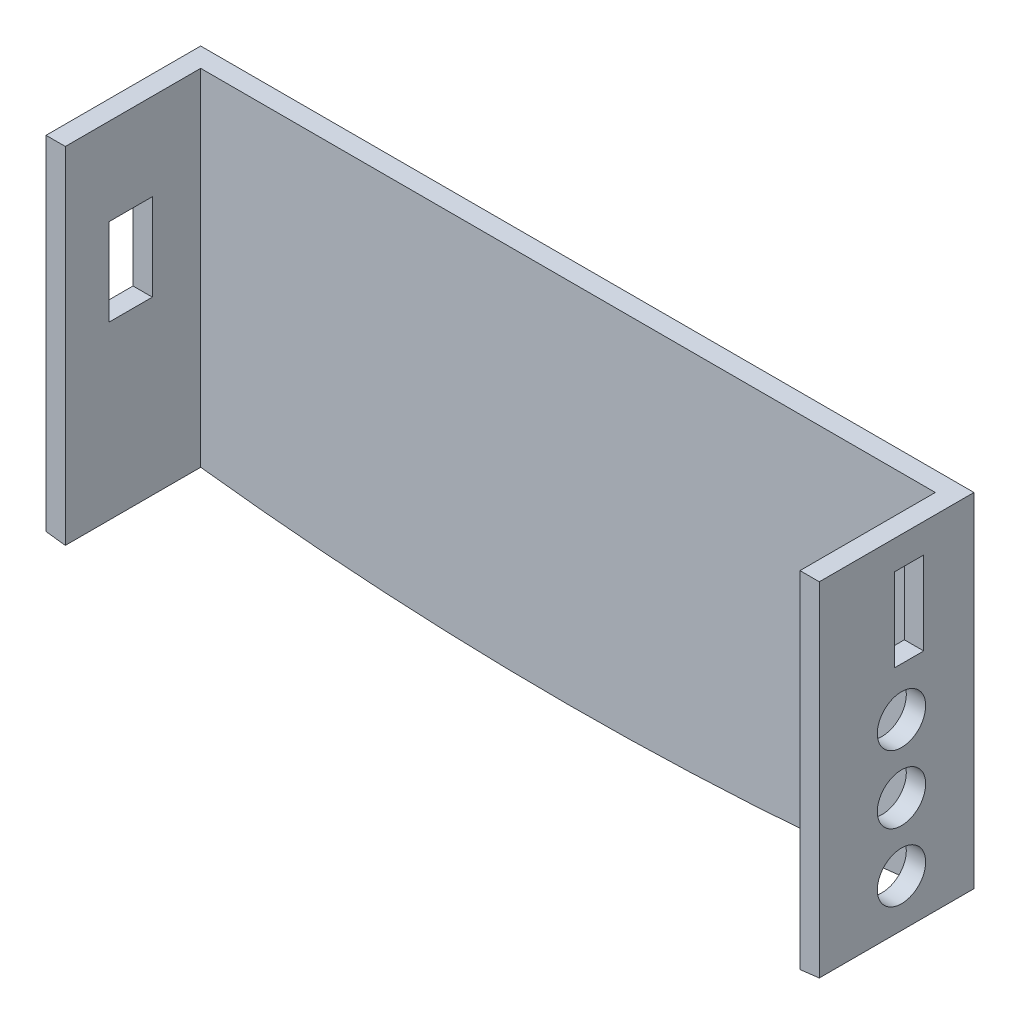
from build123d import *

# Parameters (mm, degrees)
SKETCH_1_W          = 80
SKETCH_1_H          = 35.5
EXTRUDE_1_DEPTH     = 16
SHELL_1_T           = -2
CUT_EXTRUDE_3_REACH = 89.513
SKETCH_2_W          = 4.5
SKETCH_2_H          = 9
CUT_EXTRUDE_4_REACH = 89.513
SKETCH_6_R          = 2.5
SKETCH_6_W          = 3
SKETCH_6_H          = 8.6


with BuildPart() as part:
    # 草图1 → 凸台-拉伸1 (new body)
    with BuildSketch(Plane.XY):
        with Locations((-50.420566467, -11.417328482)):
            Rectangle(SKETCH_1_W, SKETCH_1_H)
        with BuildLine():
            Line((-10.420566467, -29.167328482), (-90.420566467, -29.167328482))
            ThreePointArc((-90.420566467, -29.167328482), (-50.420566467, -31.663413079), (-10.420566467, -29.167328482))
        make_face()
    extrude(amount=EXTRUDE_1_DEPTH)

    # 抽壳1
    shell_1_openings = [part.faces().sort_by_distance(p)[0] for p in [
        (-50.420566467, -12.25744671, 16),
        (-50.420566467, 6.332671518, 8),
        (-50.420566467, -31.663413079, 8),
    ]]
    offset(amount=SHELL_1_T, openings=shell_1_openings, kind=Kind.INTERSECTION)

    # 草图2 → 切除-拉伸3 (cut, up to next)
    with BuildSketch(Plane.ZY.offset(90.420566467), mode=Mode.PRIVATE) as cut_extrude_3_sk1:
        with Locations((9.25, -7.167328482)):
            Rectangle(SKETCH_2_W, SKETCH_2_H)
    cut_extrude_3_tool1 = extrude(cut_extrude_3_sk1.sketch, amount=-CUT_EXTRUDE_3_REACH, mode=Mode.PRIVATE) & part.part
    add(cut_extrude_3_tool1.solids().sort_by_distance((-90.420566, -7.167328, 9.25))[0], mode=Mode.SUBTRACT)

    # 草图6 → 切除-拉伸4 (cut, up to next)
    with BuildSketch(Plane(origin=(-10.420566467, 0, 0), x_dir=(0, 0, -1), z_dir=(1, 0, 0)), mode=Mode.PRIVATE) as cut_extrude_4_sk1:
        with Locations((-7.5, -10.267328482)):
            Circle(SKETCH_6_R)
    cut_extrude_4_tool1 = extrude(cut_extrude_4_sk1.sketch, amount=-CUT_EXTRUDE_4_REACH, mode=Mode.PRIVATE) & part.part
    # 草图6 → 切除-拉伸4 (cut, up to next)
    with BuildSketch(Plane(origin=(-10.420566467, 0, 0), x_dir=(0, 0, -1), z_dir=(1, 0, 0)), mode=Mode.PRIVATE) as cut_extrude_4_sk2:
        with Locations((-7.5, -17.267328482)):
            Circle(SKETCH_6_R)
    cut_extrude_4_tool2 = extrude(cut_extrude_4_sk2.sketch, amount=-CUT_EXTRUDE_4_REACH, mode=Mode.PRIVATE) & part.part
    # 草图6 → 切除-拉伸4 (cut, up to next)
    with BuildSketch(Plane(origin=(-10.420566467, 0, 0), x_dir=(0, 0, -1), z_dir=(1, 0, 0)), mode=Mode.PRIVATE) as cut_extrude_4_sk3:
        with Locations((-7.5, -24.267328482)):
            Circle(SKETCH_6_R)
    cut_extrude_4_tool3 = extrude(cut_extrude_4_sk3.sketch, amount=-CUT_EXTRUDE_4_REACH, mode=Mode.PRIVATE) & part.part
    # 草图6 → 切除-拉伸4 (cut, up to next)
    with BuildSketch(Plane(origin=(-10.420566467, 0, 0), x_dir=(0, 0, -1), z_dir=(1, 0, 0)), mode=Mode.PRIVATE) as cut_extrude_4_sk4:
        with Locations((-6.7, -0.967328482)):
            Rectangle(SKETCH_6_W, SKETCH_6_H)
    cut_extrude_4_tool4 = extrude(cut_extrude_4_sk4.sketch, amount=-CUT_EXTRUDE_4_REACH, mode=Mode.PRIVATE) & part.part
    add(cut_extrude_4_tool1.solids().sort_by_distance((-10.420566, -10.267328, 7.5))[0], mode=Mode.SUBTRACT)
    add(cut_extrude_4_tool2.solids().sort_by_distance((-10.420566, -17.267328, 7.5))[0], mode=Mode.SUBTRACT)
    add(cut_extrude_4_tool3.solids().sort_by_distance((-10.420566, -24.267328, 7.5))[0], mode=Mode.SUBTRACT)
    add(cut_extrude_4_tool4.solids().sort_by_distance((-10.420566, -0.967328, 6.7))[0], mode=Mode.SUBTRACT)


solid = part.part
